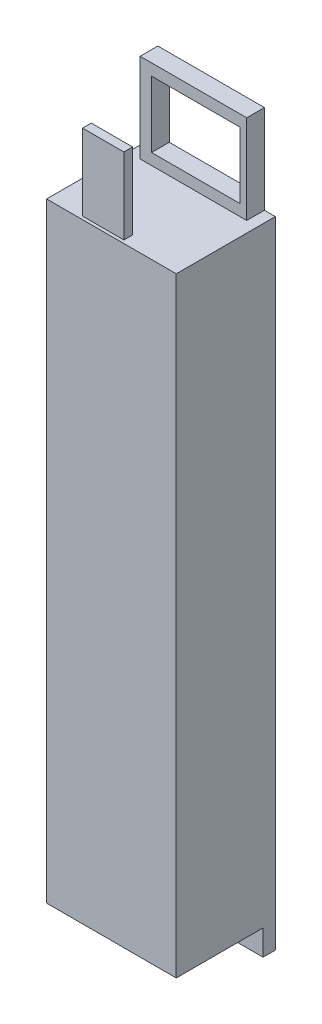
from build123d import *

# Parameters (mm, degrees)
SKETCH_1_W          = 51
SKETCH_1_H          = 39
EXTRUDE_1_DEPTH     = 240
SKETCH_2_W          = 41.961119827
SKETCH_2_H          = 6.971123129
EXTRUDE_2_DEPTH     = 35
SKETCH_3_W          = 16.244799638
SKETCH_3_H          = 3.419957818
EXTRUDE_3_DEPTH     = 30
SKETCH_4_W          = 51
SKETCH_4_H          = 4.841751688
EXTRUDE_4_DEPTH     = 10
SKETCH_5_W          = 44.706396848
SKETCH_5_H          = 29.024048215
CUT_EXTRUDE_1_DEPTH = 10
SKETCH_6_W          = 34.715500368
SKETCH_6_H          = 26.036625276
CUT_EXTRUDE_2_DEPTH = 10


with BuildPart() as part:
    # 草图1 → 凸台-拉伸1 (new body)
    with BuildSketch(Plane(origin=(0, 0, 0), x_dir=(1, 0, 0), z_dir=(0, 1, 0))):
        with Locations((25.5, 19.5)):
            Rectangle(SKETCH_1_W, SKETCH_1_H)
    extrude(amount=EXTRUDE_1_DEPTH)

    # 草图2 → 凸台-拉伸2 (add)
    with BuildSketch(Plane(origin=(0, 240, 0), x_dir=(1, 0, 0), z_dir=(0, 1, 0))):
        with Locations((25.724627293, 35.514438435)):
            Rectangle(SKETCH_2_W, SKETCH_2_H)
    extrude(amount=EXTRUDE_2_DEPTH)

    # 草图3 → 凸台-拉伸3 (add)
    with BuildSketch(Plane(origin=(0, 240, 0), x_dir=(1, 0, 0), z_dir=(0, 1, 0))):
        with Locations((21.054054836, 2.926937994)):
            Rectangle(SKETCH_3_W, SKETCH_3_H)
    extrude(amount=EXTRUDE_3_DEPTH)

    # 草图4 → 凸台-拉伸4 (add)
    with BuildSketch(Plane.XZ):
        with Locations((25.5, -36.579124156)):
            Rectangle(SKETCH_4_W, SKETCH_4_H)
    extrude(amount=EXTRUDE_4_DEPTH)

    # 草图5 → 切除-拉伸1 (cut)
    with BuildSketch(Plane.XZ):
        with Locations((25.96812981, -17.773771326)):
            Rectangle(SKETCH_5_W, SKETCH_5_H)
    extrude(amount=-CUT_EXTRUDE_1_DEPTH, mode=Mode.SUBTRACT)

    # 草图6 → 切除-拉伸2 (cut)
    with BuildSketch(Plane.XY.offset(-32.028876871)):
        with Locations((26.608486618, 257.459000656)):
            Rectangle(SKETCH_6_W, SKETCH_6_H)
    extrude(amount=-CUT_EXTRUDE_2_DEPTH, mode=Mode.SUBTRACT)


solid = part.part
